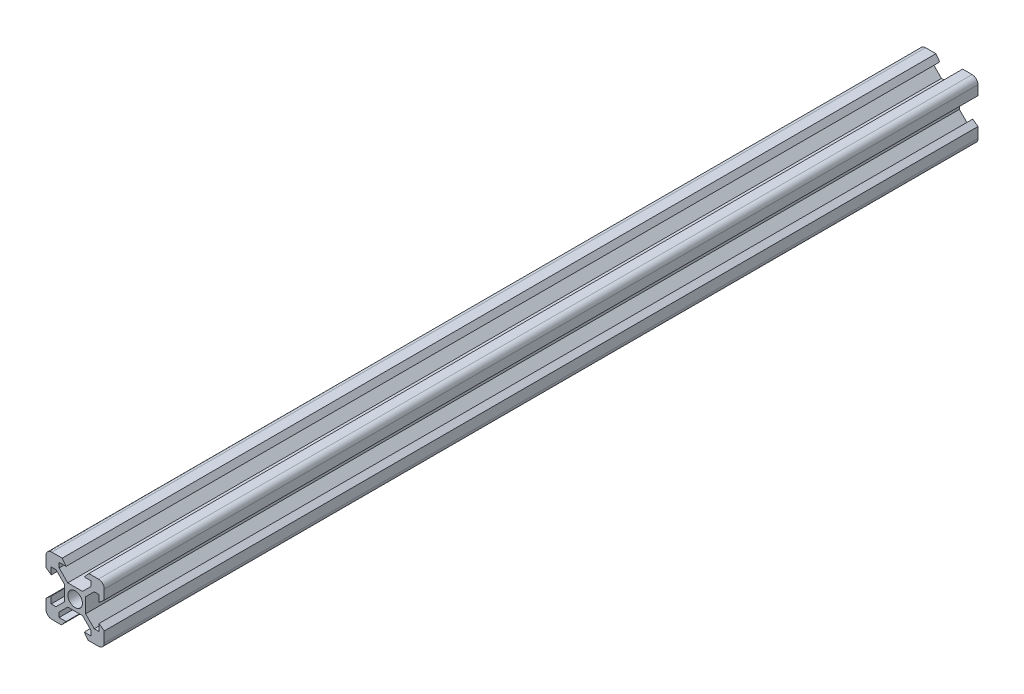
from build123d import *

# Parameters (mm, degrees)
SKETCH1_R           = 2.5
BOSS_EXTRUDE1_DEPTH = 300


with BuildPart() as part:
    # Sketch1 → Boss-Extrude1 (new body)
    with BuildSketch(Plane.XY):
        with BuildLine():
            Line((-4.725542729, -10), (-3.125, -8.2))
            Line((-3.125, -8.2), (-5.5, -8.2))
            Line((-5.5, -8.2), (-5.5, -6.560660172))
            Line((-5.5, -6.560660172), (-2.539339828, -3.6))
            Line((-2.539339828, -3.6), (2.539339828, -3.6))
            Line((2.539339828, -3.6), (5.5, -6.560660172))
            Line((5.5, -6.560660172), (5.5, -8.2))
            Line((5.5, -8.2), (3.125, -8.2))
            Line((3.125, -8.2), (4.434457271, -10))
            Line((4.434457271, -10), (8, -10))
            ThreePointArc((8, -10), (9.414213562, -9.414213562), (10, -8))
            Line((10, -8), (10, -4.434457271))
            Line((10, -4.434457271), (8.2, -3.125))
            Line((8.2, -3.125), (8.2, -5.5))
            Line((8.2, -5.5), (6.560660172, -5.5))
            Line((6.560660172, -5.5), (3.6, -2.539339828))
            Line((3.6, -2.539339828), (3.6, 2.539339828))
            Line((3.6, 2.539339828), (6.560660172, 5.5))
            Line((6.560660172, 5.5), (8.2, 5.5))
            Line((8.2, 5.5), (8.2, 3.125))
            Line((8.2, 3.125), (10, 4.725542729))
            Line((10, 4.725542729), (10, 8))
            ThreePointArc((10, 8), (9.414213562, 9.414213562), (8, 10))
            Line((8, 10), (4.725542729, 10))
            Line((4.725542729, 10), (3.125, 8.2))
            Line((3.125, 8.2), (5.5, 8.2))
            Line((5.5, 8.2), (5.5, 6.560660172))
            Line((5.5, 6.560660172), (2.539339828, 3.6))
            Line((2.539339828, 3.6), (-2.539339828, 3.6))
            Line((-2.539339828, 3.6), (-5.5, 6.560660172))
            Line((-5.5, 6.560660172), (-5.5, 8.2))
            Line((-5.5, 8.2), (-3.125, 8.2))
            Line((-3.125, 8.2), (-4.434457271, 10))
            Line((-4.434457271, 10), (-8, 10))
            ThreePointArc((-8, 10), (-9.414213562, 9.414213562), (-10, 8))
            Line((-10, 8), (-10, 4.434457271))
            Line((-10, 4.434457271), (-8.2, 3.125))
            Line((-8.2, 3.125), (-8.2, 5.5))
            Line((-8.2, 5.5), (-6.560660172, 5.5))
            Line((-6.560660172, 5.5), (-3.6, 2.539339828))
            Line((-3.6, 2.539339828), (-3.6, -2.539339828))
            Line((-3.6, -2.539339828), (-6.560660172, -5.5))
            Line((-6.560660172, -5.5), (-8.2, -5.5))
            Line((-8.2, -5.5), (-8.2, -3.125))
            Line((-8.2, -3.125), (-10, -4.725542729))
            Line((-10, -4.725542729), (-10, -8))
            ThreePointArc((-10, -8), (-9.414213562, -9.414213562), (-8, -10))
            Line((-8, -10), (-4.725542729, -10))
        make_face()
        Circle(SKETCH1_R, mode=Mode.SUBTRACT)
    extrude(amount=BOSS_EXTRUDE1_DEPTH)


solid = part.part
